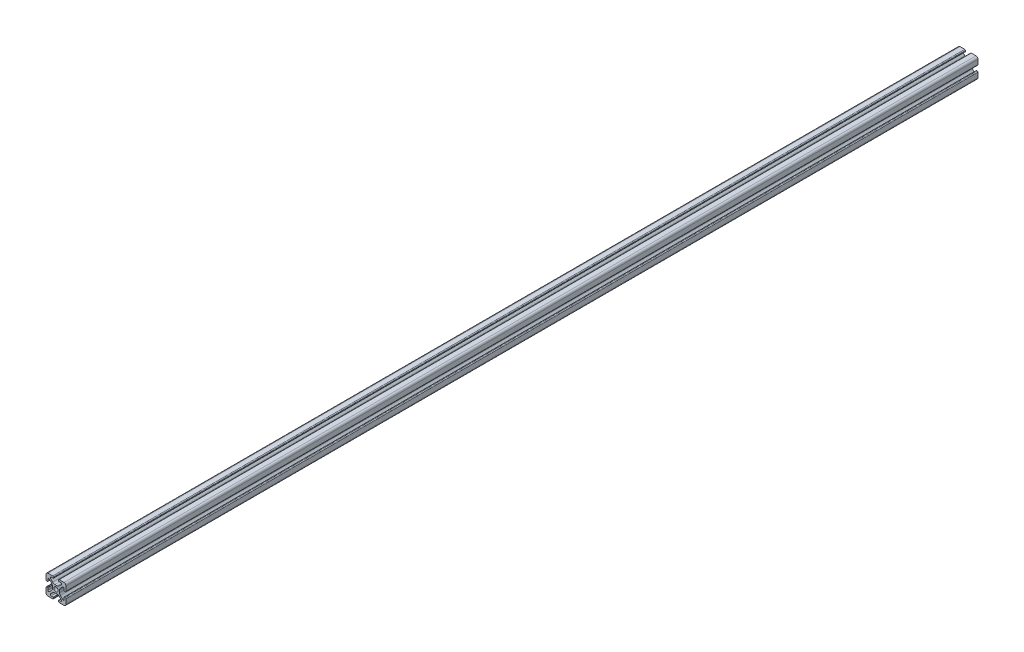
from build123d import *

# Parameters (mm, degrees)
SKETCH1_R           = 2.1463
BOSS_EXTRUDE1_DEPTH = 457.2


with BuildPart() as part:
    # Sketch1 → Boss-Extrude1 (new, symmetric)
    with BuildSketch(Plane.XY):
        with BuildLine():
            Line((-9.9949, 7.9883), (-9.9949, 3.2893))
            ThreePointArc((-9.9949, 3.2893), (-9.76427588, 2.73252412), (-9.2075, 2.5019))
            Line((-9.2075, 2.5019), (-8.4963, 2.5019))
            ThreePointArc((-8.4963, 2.5019), (-8.280773853, 2.591173853), (-8.1915, 2.8067))
            Line((-8.1915, 2.8067), (-8.1915, 4.9149))
            ThreePointArc((-8.1915, 4.9149), (-7.674065253, 5.689295824), (-6.760603096, 5.507596904))
            Line((-6.760603096, 5.507596904), (-4.505765747, 3.252759555))
            ThreePointArc((-4.505765747, 3.252759555), (-3.856054457, 2.280397894), (-3.627906192, 1.133419111))
            Line((-3.627906192, 1.133419111), (-3.627906192, -1.133419111))
            ThreePointArc((-3.627906192, -1.133419111), (-3.856054457, -2.280397894), (-4.505765747, -3.252759555))
            Line((-4.505765747, -3.252759555), (-6.760603096, -5.507596904))
            ThreePointArc((-6.760603096, -5.507596904), (-7.674065253, -5.689295824), (-8.1915, -4.9149))
            Line((-8.1915, -4.9149), (-8.1915, -2.8067))
            ThreePointArc((-8.1915, -2.8067), (-8.280773853, -2.591173853), (-8.4963, -2.5019))
            Line((-8.4963, -2.5019), (-9.2075, -2.5019))
            ThreePointArc((-9.2075, -2.5019), (-9.76427588, -2.73252412), (-9.9949, -3.2893))
            Line((-9.9949, -3.2893), (-9.9949, -7.9883))
            ThreePointArc((-9.9949, -7.9883), (-9.407180467, -9.407180467), (-7.9883, -9.9949))
            Line((-7.9883, -9.9949), (-3.2893, -9.9949))
            ThreePointArc((-3.2893, -9.9949), (-2.73252412, -9.76427588), (-2.5019, -9.2075))
            Line((-2.5019, -9.2075), (-2.5019, -8.4963))
            ThreePointArc((-2.5019, -8.4963), (-2.591173853, -8.280773853), (-2.8067, -8.1915))
            Line((-2.8067, -8.1915), (-4.9149, -8.1915))
            ThreePointArc((-4.9149, -8.1915), (-5.689295824, -7.674065253), (-5.507596904, -6.760603096))
            Line((-5.507596904, -6.760603096), (-3.252759555, -4.505765747))
            ThreePointArc((-3.252759555, -4.505765747), (-2.280397894, -3.856054457), (-1.133419111, -3.627906192))
            Line((-1.133419111, -3.627906192), (1.133419111, -3.627906192))
            ThreePointArc((1.133419111, -3.627906192), (2.280397894, -3.856054457), (3.252759555, -4.505765747))
            Line((3.252759555, -4.505765747), (5.507596904, -6.760603096))
            ThreePointArc((5.507596904, -6.760603096), (5.689295824, -7.674065253), (4.9149, -8.1915))
            Line((4.9149, -8.1915), (2.8067, -8.1915))
            ThreePointArc((2.8067, -8.1915), (2.591173853, -8.280773853), (2.5019, -8.4963))
            Line((2.5019, -8.4963), (2.5019, -9.2075))
            ThreePointArc((2.5019, -9.2075), (2.73252412, -9.76427588), (3.2893, -9.9949))
            Line((3.2893, -9.9949), (7.9883, -9.9949))
            ThreePointArc((7.9883, -9.9949), (9.407180467, -9.407180467), (9.9949, -7.9883))
            Line((9.9949, -7.9883), (9.9949, -3.2893))
            ThreePointArc((9.9949, -3.2893), (9.76427588, -2.73252412), (9.2075, -2.5019))
            Line((9.2075, -2.5019), (8.4963, -2.5019))
            ThreePointArc((8.4963, -2.5019), (8.280773853, -2.591173853), (8.1915, -2.8067))
            Line((8.1915, -2.8067), (8.1915, -4.9149))
            ThreePointArc((8.1915, -4.9149), (7.674065253, -5.689295824), (6.760603096, -5.507596904))
            Line((6.760603096, -5.507596904), (4.505765747, -3.252759555))
            ThreePointArc((4.505765747, -3.252759555), (3.856054457, -2.280397894), (3.627906192, -1.133419111))
            Line((3.627906192, -1.133419111), (3.627906192, 1.133419111))
            ThreePointArc((3.627906192, 1.133419111), (3.856054457, 2.280397894), (4.505765747, 3.252759555))
            Line((4.505765747, 3.252759555), (6.760603096, 5.507596904))
            ThreePointArc((6.760603096, 5.507596904), (7.674065253, 5.689295824), (8.1915, 4.9149))
            Line((8.1915, 4.9149), (8.1915, 2.8067))
            ThreePointArc((8.1915, 2.8067), (8.280773853, 2.591173853), (8.4963, 2.5019))
            Line((8.4963, 2.5019), (9.2075, 2.5019))
            ThreePointArc((9.2075, 2.5019), (9.76427588, 2.73252412), (9.9949, 3.2893))
            Line((9.9949, 3.2893), (9.9949, 7.9883))
            ThreePointArc((9.9949, 7.9883), (9.407180467, 9.407180467), (7.9883, 9.9949))
            Line((7.9883, 9.9949), (3.2893, 9.9949))
            ThreePointArc((3.2893, 9.9949), (2.73252412, 9.76427588), (2.5019, 9.2075))
            Line((2.5019, 9.2075), (2.5019, 8.4963))
            ThreePointArc((2.5019, 8.4963), (2.591173853, 8.280773853), (2.8067, 8.1915))
            Line((2.8067, 8.1915), (4.9149, 8.1915))
            ThreePointArc((4.9149, 8.1915), (5.689295824, 7.674065253), (5.507596904, 6.760603096))
            Line((5.507596904, 6.760603096), (3.252759555, 4.505765747))
            ThreePointArc((3.252759555, 4.505765747), (2.280397894, 3.856054457), (1.133419111, 3.627906192))
            Line((1.133419111, 3.627906192), (-1.133419111, 3.627906192))
            ThreePointArc((-1.133419111, 3.627906192), (-2.280397894, 3.856054457), (-3.252759555, 4.505765747))
            Line((-3.252759555, 4.505765747), (-5.507596904, 6.760603096))
            ThreePointArc((-5.507596904, 6.760603096), (-5.689295824, 7.674065253), (-4.9149, 8.1915))
            Line((-4.9149, 8.1915), (-2.8067, 8.1915))
            ThreePointArc((-2.8067, 8.1915), (-2.591173853, 8.280773853), (-2.5019, 8.4963))
            Line((-2.5019, 8.4963), (-2.5019, 9.2075))
            ThreePointArc((-2.5019, 9.2075), (-2.73252412, 9.76427588), (-3.2893, 9.9949))
            Line((-3.2893, 9.9949), (-7.9883, 9.9949))
            ThreePointArc((-7.9883, 9.9949), (-9.407180467, 9.407180467), (-9.9949, 7.9883))
        make_face()
        Circle(SKETCH1_R, mode=Mode.SUBTRACT)
    extrude(amount=BOSS_EXTRUDE1_DEPTH, both=True)


solid = part.part
